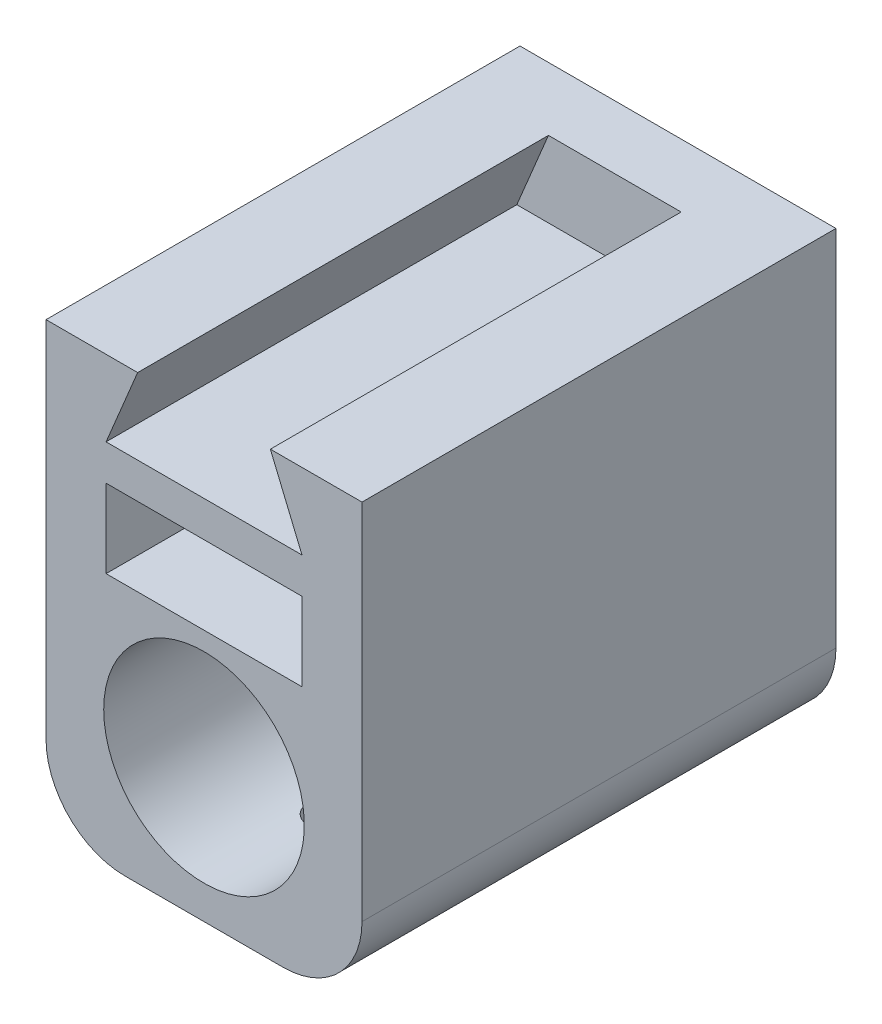
from build123d import *

# Parameters (mm, degrees)
ESBO_O1_W                = 4.958931368
ESBO_O1_H                = 12.4
RESSALTO_EXTRUS_O1_DEPTH = 30
RESSALTO_EXTRUS_O2_DEPTH = 4
FILETE1_R                = 5
ESBO_O3_R                = 1
CORTE_EXTRUS_O1_DEPTH    = 4


with BuildPart() as part:
    # Esboço1 → Ressalto-extrusão1 (new body)
    with BuildSketch(Plane(origin=(0, 0, 0), x_dir=(0, 1, 0), z_dir=(0, 0, 1))):
        Polygon((3.617797035, 6.2), (3.617797035, -6.2), (8.417797035, -4.2), (8.417797035, -10), (-11.126254615, -10), (-19.582202965, -10), (-19.582202965, 10), (-11.126254615, 10), (8.417797035, 10), (8.417797035, 4.2), align=None)
        with Locations((-1.126254615, 0)):
            Rectangle(ESBO_O1_W, ESBO_O1_H, mode=Mode.SUBTRACT)
        with BuildLine():
            ThreePointArc((-11.126254615, -6.35), (-4.776254615, 0), (-11.126254615, 6.35))
            ThreePointArc((-11.126254615, 6.35), (-17.476254615, 0), (-11.126254615, -6.35))
        make_face(mode=Mode.SUBTRACT)
    extrude(amount=RESSALTO_EXTRUS_O1_DEPTH)

    # Esboço2 → Ressalto-extrusão2 (add)
    with BuildSketch(Plane(origin=(0, 0, 0), x_dir=(0, 1, 0), z_dir=(0, 0, 1))):
        Polygon((8.417797035, -4.2), (3.617797035, -6.2), (3.617797035, 6.2), (8.417797035, 4.2), align=None)
    extrude(amount=RESSALTO_EXTRUS_O2_DEPTH)

    # Filete1
    filete1_edges = [part.edges().sort_by_distance(p)[0] for p in [
        (10, -19.582202965, 15),
        (-10, -19.582202965, 15),
    ]]
    fillet(filete1_edges, radius=FILETE1_R)

    # Esboço3 → Corte-extrusão1 (cut)
    with BuildSketch(Plane.XZ.offset(19.582202965)):
        with Locations(Location((0, 22.5, 0), (0, 0, 270))):
            Circle(ESBO_O3_R)
        with Locations(Location((0, 7.5, 0), (0, 0, 270))):
            Circle(ESBO_O3_R)
    extrude(amount=-CORTE_EXTRUS_O1_DEPTH, mode=Mode.SUBTRACT)


solid = part.part
